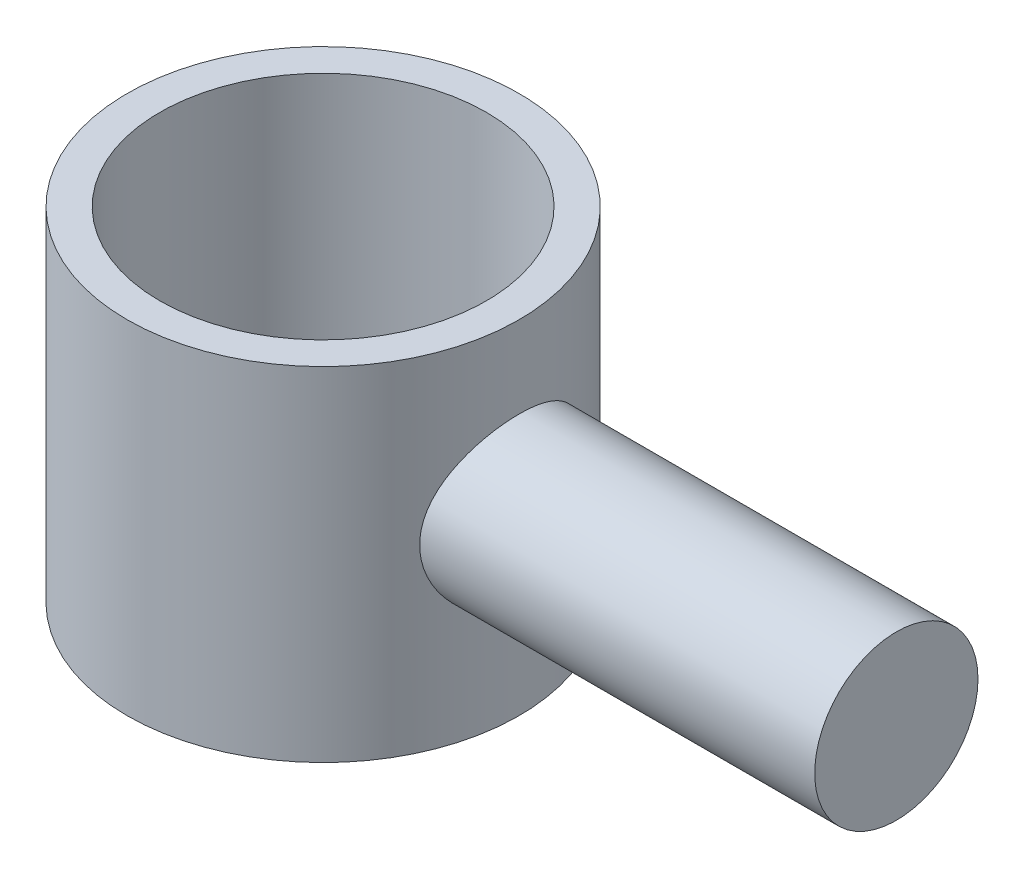
from build123d import *

# Parameters (mm, degrees)
SKETCH1_R                       = 120
SKETCH1_R_2                     = 100
BOSS_EXTRUDE1_DEPTH             = 210
SKETCH2_R                       = 50
BOSS_EXTRUDE2_DEPTH             = 1
BOSS_EXTRUDE2_DIRECTION_2_REACH = 530.583


with BuildPart() as part:
    # Sketch1 → Boss-Extrude1 (new body)
    with BuildSketch(Plane(origin=(0, 0, 0), x_dir=(1, 0, 0), z_dir=(0, 1, 0))):
        with Locations(Location((0, 0, 0), (0, 0, 270))):
            Circle(SKETCH1_R)
        with Locations(Location((0, 0, 0), (0, 0, 270))):
            Circle(SKETCH1_R_2, mode=Mode.SUBTRACT)
    extrude(amount=BOSS_EXTRUDE1_DEPTH)

    # Sketch2 → Boss-Extrude2 (add)
    with BuildSketch(Plane(origin=(350, 0, 0), x_dir=(0, 0, -1), z_dir=(1, 0, 0))):
        with Locations((0, 110)):
            Circle(SKETCH2_R)
    extrude(amount=BOSS_EXTRUDE2_DEPTH)

    # Sketch2 → Boss-Extrude2 direction 2 (add, up to next)
    with BuildSketch(Plane(origin=(350, 0, 0), x_dir=(0, 0, -1), z_dir=(1, 0, 0)), mode=Mode.PRIVATE) as boss_extrude2_direction_2_sk1:
        with Locations((0, 110)):
            Circle(SKETCH2_R)
    boss_extrude2_direction_2_tool1 = extrude(boss_extrude2_direction_2_sk1.sketch, amount=-BOSS_EXTRUDE2_DIRECTION_2_REACH, mode=Mode.PRIVATE) - part.part
    add(boss_extrude2_direction_2_tool1.solids().sort_by_distance((350, 110, 0))[0])


solid = part.part
